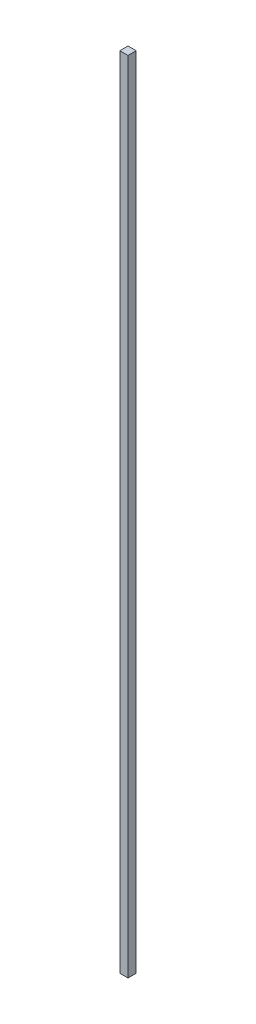
from build123d import *

# Parameters (mm, degrees)
SKETCH1_W           = 3.175
SKETCH1_H           = 3.175
BOSS_EXTRUDE1_DEPTH = 310


with BuildPart() as part:
    # Sketch1 → Boss-Extrude1 (new body)
    with BuildSketch(Plane(origin=(0, 0, 0), x_dir=(1, 0, 0), z_dir=(0, 1, 0))):
        Rectangle(SKETCH1_W, SKETCH1_H)
    extrude(amount=BOSS_EXTRUDE1_DEPTH)


solid = part.part
